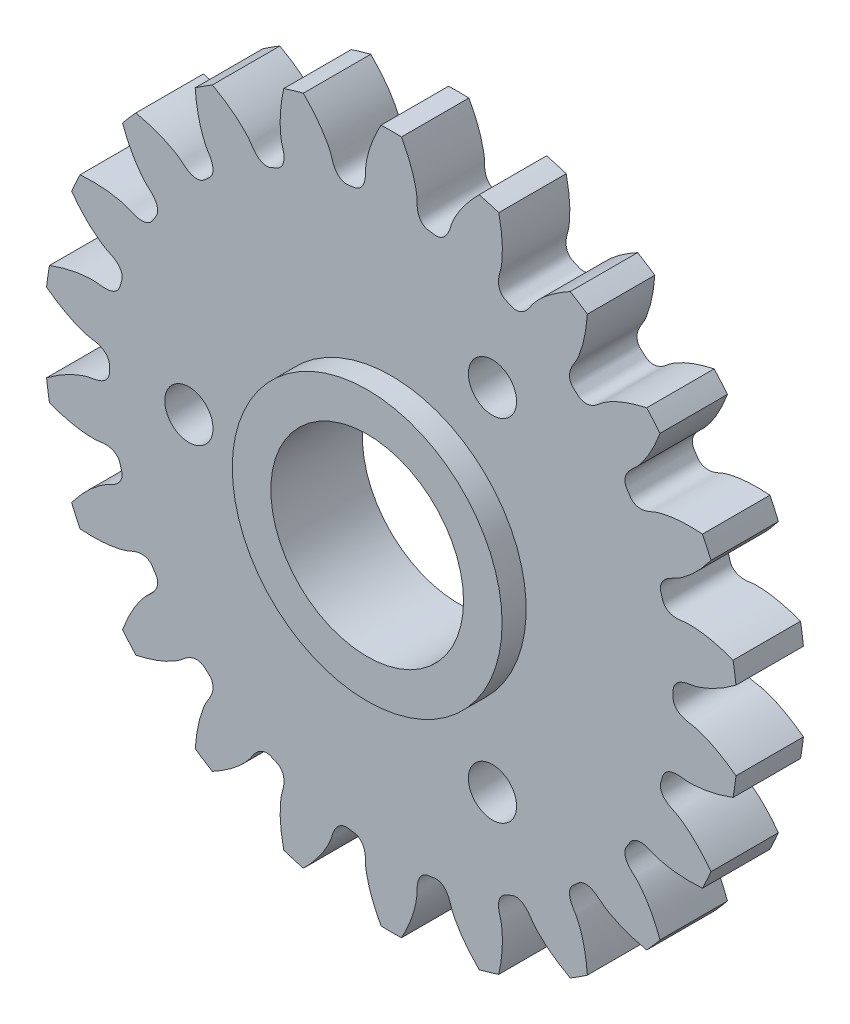
from build123d import *

# Parameters (mm, degrees)
SKETCH_345_W               = 7
SKETCH_345_H               = 35.999999459
CUT_EXTRUDE_566_DEPTH      = 52.031852035
PATTERN_CIRCULAR_607_COUNT = 22
SKETCH_8_R                 = 2.5
SKETCH_8_R_2               = 10
CUT_EXTRUDE_4_DEPTH        = 10
EXTRUDE_START              = 2.5
SKETCH_9_R                 = 14
SKETCH_9_R_2               = 10
EXTRUDE_1_DEPTH            = 2.5
HOLE_WIZARD_2_D            = 5
HOLE_WIZARD_2_CSINK_D      = 11.2
HOLE_WIZARD_2_CSINK_ANGLE  = 90


with BuildPart() as part:
    # Sketch 345 → Revolve 409 (revolve)
    with BuildSketch(Plane(origin=(0, 0, 0), x_dir=(0, 0, -1), z_dir=(1, 0, 0))):
        with Locations((0, 17.99999973)):
            Rectangle(SKETCH_345_W, SKETCH_345_H)
    revolve(axis=Axis((0, 0, 0), (0, 0, -1)))

    # Sketch 454 → Cut-Extrude 566 (cut, symmetric)
    with BuildSketch(Plane.XY):
        with BuildLine():
            ThreePointArc((35.90766618, 4.178752232), (36.149999457, 0), (35.90766618, -4.178752232))
            add(Edge.make_bspline(
                [(35.90766618, -4.178752232), (35.628238269, -3.963843366), (35.211198134, -3.661483958), (34.652865266, -3.294731532), (34.261637286, -3.054191451), (33.887522935, -2.839328127), (33.531687665, -2.648888493), (33.195236859, -2.481572821), (32.879214102, -2.336037822), (32.584599556, -2.210899298), (32.312308572, -2.104733886), (32.063189882, -2.016084629), (31.838025593, -1.943454334), (31.637525895, -1.885337801), (31.462340569, -1.840133714), (31.313020159, -1.806420474), (31.085587674, -1.761540639), (30.877288834, -1.739946622), (30.686155038, -1.701057539), (30.604819386, -1.682711729), (30.525180578, -1.662583318), (30.447159996, -1.640688142), (30.37068474, -1.616926974), (30.295671017, -1.59120275), (30.222029192, -1.563383972), (30.149664049, -1.533307327), (30.078477696, -1.500768649), (30.008373831, -1.46551557), (29.939264674, -1.427238383), (29.871081535, -1.385560424), (29.803790504, -1.34002854), (29.737415007, -1.290105321), (29.672067151, -1.235165946), (29.607989427, -1.174504285), (29.545606926, -1.107355223), (29.485587114, -1.032942366), (29.428897802, -0.950561474), (29.3768471, -0.859706382), (29.33107204, -0.760236848), (29.293467726, -0.652557083), (29.265940272, -0.537791742), (29.251428742, -0.425962534), (29.245110424, -0.246124591), (29.253740712, 0), (29.245110424, 0.246124591), (29.251428742, 0.425962534), (29.265940272, 0.537791742), (29.293467726, 0.652557083), (29.33107204, 0.760236848), (29.3768471, 0.859706382), (29.428897802, 0.950561474), (29.485587114, 1.032942366), (29.545606926, 1.107355223), (29.607989427, 1.174504285), (29.672067151, 1.235165946), (29.737415007, 1.290105321), (29.803790504, 1.34002854), (29.871081535, 1.385560424), (29.939264674, 1.427238383), (30.008373831, 1.46551557), (30.078477696, 1.500768649), (30.149664049, 1.533307327), (30.222029192, 1.563383972), (30.295671017, 1.59120275), (30.37068474, 1.616926974), (30.447159996, 1.640688142), (30.525180578, 1.662583318), (30.604819386, 1.682711729), (30.686155038, 1.701057539), (30.877288834, 1.739946622), (31.085587674, 1.761540639), (31.313020159, 1.806420474), (31.462340569, 1.840133714), (31.637525895, 1.885337801), (31.838025593, 1.943454334), (32.063189882, 2.016084629), (32.312308572, 2.104733886), (32.584599556, 2.210899298), (32.879214102, 2.336037822), (33.195236859, 2.481572821), (33.531687665, 2.648888493), (33.887522935, 2.839328127), (34.261637286, 3.054191451), (34.652865266, 3.294731532), (35.211198134, 3.661483958), (35.628238269, 3.963843366), (35.90766618, 4.178752232)],
                knots=[0, 0, 0, 0, 0.063462617, 0.092688822, 0.120244958, 0.146131025, 0.170347024, 0.192892954, 0.213768815, 0.232974607, 0.25051033, 0.266375985, 0.280571571, 0.293097088, 0.303952536, 0.313137916, 0.320653227, 0.345676389, 0.3507593, 0.355760281, 0.360686414, 0.365545723, 0.370347327, 0.375101604, 0.379820382, 0.384517156, 0.389207322, 0.393908432, 0.398640446, 0.403425963, 0.40829039, 0.41326197, 0.418371582, 0.423652136, 0.429137392, 0.434859943, 0.440848149, 0.447121936, 0.453687692, 0.460533012, 0.467622686, 0.474897737, 0.480791834, 0.5, 0.519208166, 0.525102263, 0.532377314, 0.539466988, 0.546312308, 0.552878064, 0.559151851, 0.565140057, 0.570862608, 0.576347864, 0.581628418, 0.58673803, 0.59170961, 0.596574037, 0.601359554, 0.606091568, 0.610792678, 0.615482844, 0.620179618, 0.624898396, 0.629652673, 0.634454277, 0.639313586, 0.644239719, 0.6492407, 0.654323611, 0.679346773, 0.686862084, 0.696047464, 0.706902912, 0.719428429, 0.733624015, 0.74948967, 0.767025393, 0.786231185, 0.807107046, 0.829652976, 0.853868975, 0.879755042, 0.907311178, 0.936537383, 1, 1, 1, 1], degree=3))
        make_face()
    cut_extrude_566 = extrude(amount=CUT_EXTRUDE_566_DEPTH, both=True, mode=Mode.SUBTRACT)

    # Pattern Circular 607: Cut-Extrude 566 ×22 about axis
    pattern_circular_607_axis = Axis((0, 0, 50), (0, 0, -1))
    for i in range(1, PATTERN_CIRCULAR_607_COUNT):
        add(cut_extrude_566.rotate(pattern_circular_607_axis, i * 360 / PATTERN_CIRCULAR_607_COUNT), mode=Mode.SUBTRACT)

    # 草图8 → 切除-拉伸4 (cut)
    with BuildSketch(Plane.XY.offset(3.5)):
        with Locations((-21, 0)):
            Circle(SKETCH_8_R)
        with Locations((10.5, 18.186533479)):
            Circle(SKETCH_8_R)
        with Locations((10.5, -18.186533479)):
            Circle(SKETCH_8_R)
        Circle(SKETCH_8_R_2)
    extrude(amount=-CUT_EXTRUDE_4_DEPTH, mode=Mode.SUBTRACT)

    # 草图9 → 凸台-拉伸1 (add)
    with BuildSketch(Plane.XY.offset(3.5).offset(EXTRUDE_START)):
        Circle(SKETCH_9_R)
        Circle(SKETCH_9_R_2, mode=Mode.SUBTRACT)
    extrude(amount=-EXTRUDE_1_DEPTH)

    # 打孔尺寸(%根据十字)槽沉头木螺钉的类型2 (through all)
    with Locations(Plane(origin=(-21, 0, -3.5), x_dir=(-1, 0, 0), z_dir=(0, 0, -1))):
        with Locations((0, 0), (-31.5, -18.186533479), (-31.5, 18.186533479)):
            CounterSinkHole(HOLE_WIZARD_2_D / 2, HOLE_WIZARD_2_CSINK_D / 2, counter_sink_angle=HOLE_WIZARD_2_CSINK_ANGLE)


solid = part.part
